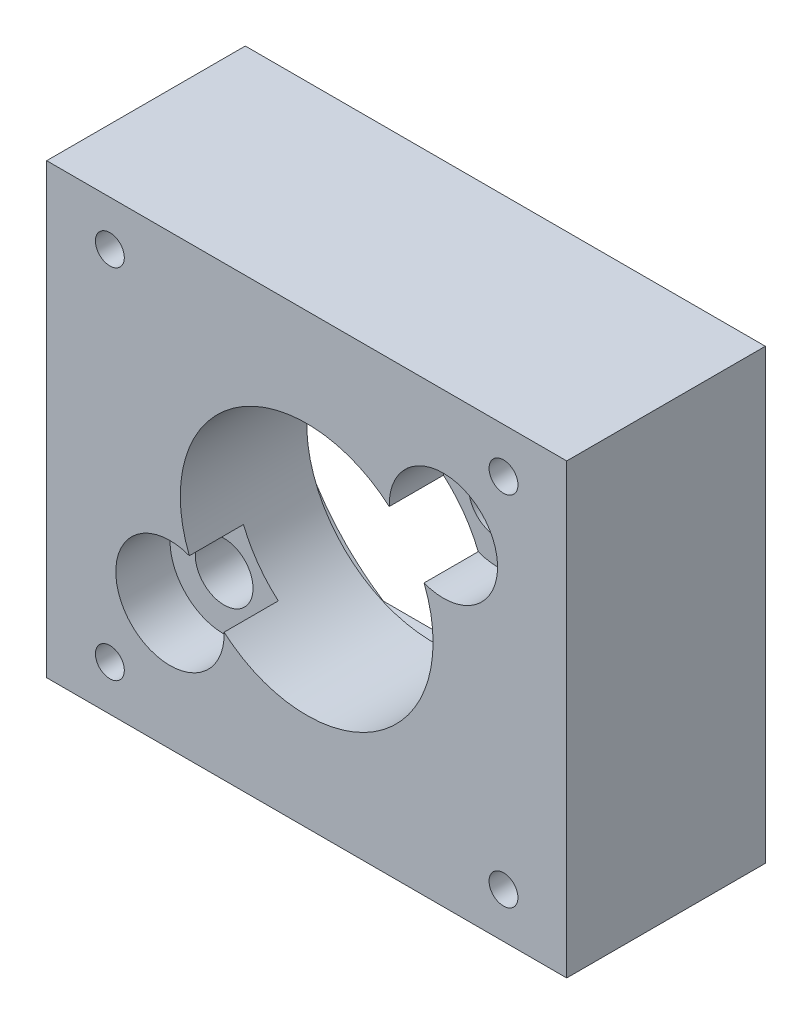
from build123d import *

# Parameters (mm, degrees)
SKETCH_1_W          = 14.4
SKETCH_1_H          = 12.4
EXTRUDE_1_DEPTH     = 3.5
SKETCH_3_R          = 0.8
SKETCH_3_R_2        = 3.5
CUT_EXTRUDE_1_DEPTH = 11.125709852
SKETCH_3_3_R        = 1.5
CUT_EXTRUDE_2_DEPTH = 1.5
EXTRUDE_2_DEPTH     = 2
SKETCH_5_R          = 0.4
CUT_EXTRUDE_3_DEPTH = 11.978615578


with BuildPart() as part:
    # 草图1 → 凸台-拉伸1 (new body)
    with BuildSketch(Plane.XY):
        Rectangle(SKETCH_1_W, SKETCH_1_H)
    extrude(amount=EXTRUDE_1_DEPTH)

    # 草图3 → 切除-拉伸1 (cut, through all)
    with BuildSketch(Plane.XY.offset(3.5)):
        with Locations((3.785828839, 2.7)):
            Circle(SKETCH_3_R)
        with Locations((-3.785828839, -2.7)):
            Circle(SKETCH_3_R)
        Circle(SKETCH_3_R_2)
    extrude(amount=-CUT_EXTRUDE_1_DEPTH, mode=Mode.SUBTRACT)

    # 草图3<3> → 切除-拉伸2 (cut)
    with BuildSketch(Plane.XY.offset(3.5)):
        with Locations((3.785828839, 2.7)):
            Circle(SKETCH_3_3_R)
        with Locations((-3.785828839, -2.7)):
            Circle(SKETCH_3_3_R)
    extrude(amount=-CUT_EXTRUDE_2_DEPTH, mode=Mode.SUBTRACT)

    # 草图4 → 凸台-拉伸2 (add)
    with BuildSketch(Plane(origin=(0, 0, 0), x_dir=(-1, 0, 0), z_dir=(0, 0, -1))):
        with BuildLine():
            Line((-6.2, 0), (-6.2, 5.2))
            Line((-6.2, 5.2), (-3.376388603, 5.2))
            ThreePointArc((-3.376388603, 5.2), (-1.760681692, 5.944745577), (-1.3e-08, 6.2))
            Line((-1.3e-08, 6.2), (-7.2, 6.2))
            Line((-7.2, 6.2), (-7.2, -6.2))
            Line((-7.2, -6.2), (0, -6.2))
            ThreePointArc((0, -6.2), (-1.760681686, -5.944745579), (-3.376388603, -5.2))
            Line((-3.376388603, -5.2), (-6.2, -5.2))
            Line((-6.2, -5.2), (-6.2, 0))
        make_face()
        with BuildLine():
            ThreePointArc((-1.3e-08, 6.2), (1.76068168, 5.944745581), (3.376388603, 5.2))
            Line((3.376388603, 5.2), (6.2, 5.2))
            Line((6.2, 5.2), (6.2, 0))
            Line((6.2, 0), (6.2, -5.2))
            Line((6.2, -5.2), (3.376388603, -5.2))
            ThreePointArc((3.376388603, -5.2), (1.760681686, -5.944745579), (0, -6.2))
            Line((0, -6.2), (7.2, -6.2))
            Line((7.2, -6.2), (7.2, 6.2))
            Line((7.2, 6.2), (-1.3e-08, 6.2))
        make_face()
        with BuildLine():
            Line((3.376388603, -5.2), (-3.376388603, -5.2))
            ThreePointArc((-3.376388603, -5.2), (-1.760681686, -5.944745579), (0, -6.2))
            ThreePointArc((0, -6.2), (1.760681686, -5.944745579), (3.376388603, -5.2))
        make_face()
        with BuildLine():
            ThreePointArc((-3.376388603, -5.2), (-5.448559871, -2.958579952), (-6.2, 0))
            Line((-6.2, 0), (-6.2, -5.2))
            Line((-6.2, -5.2), (-3.376388603, -5.2))
        make_face()
        with BuildLine():
            Line((-3.376388603, 5.2), (-6.2, 5.2))
            Line((-6.2, 5.2), (-6.2, 0))
            ThreePointArc((-6.2, 0), (-5.448559871, 2.958579952), (-3.376388603, 5.2))
        make_face()
        with BuildLine():
            ThreePointArc((-1.3e-08, 6.2), (-1.760681692, 5.944745577), (-3.376388603, 5.2))
            Line((-3.376388603, 5.2), (3.376388603, 5.2))
            ThreePointArc((3.376388603, 5.2), (1.76068168, 5.944745581), (-1.3e-08, 6.2))
        make_face()
        with BuildLine():
            Line((6.2, 5.2), (3.376388603, 5.2))
            ThreePointArc((3.376388603, 5.2), (5.448559871, 2.958579952), (6.2, 0))
            Line((6.2, 0), (6.2, 5.2))
        make_face()
        with BuildLine():
            Line((6.2, -5.2), (6.2, 0))
            ThreePointArc((6.2, 0), (5.448559871, -2.958579952), (3.376388603, -5.2))
            Line((3.376388603, -5.2), (6.2, -5.2))
        make_face()
    extrude(amount=EXTRUDE_2_DEPTH)

    # 草图5 → 切除-拉伸3 (cut, through all)
    with BuildSketch(Plane.XY.offset(3.5)):
        with Locations((-5.45, 4.95)):
            Circle(SKETCH_5_R)
        with Locations((5.45, 4.95)):
            Circle(SKETCH_5_R)
        with Locations((5.45, -4.95)):
            Circle(SKETCH_5_R)
        with Locations((-5.45, -4.95)):
            Circle(SKETCH_5_R)
    extrude(amount=-CUT_EXTRUDE_3_DEPTH, mode=Mode.SUBTRACT)


solid = part.part
